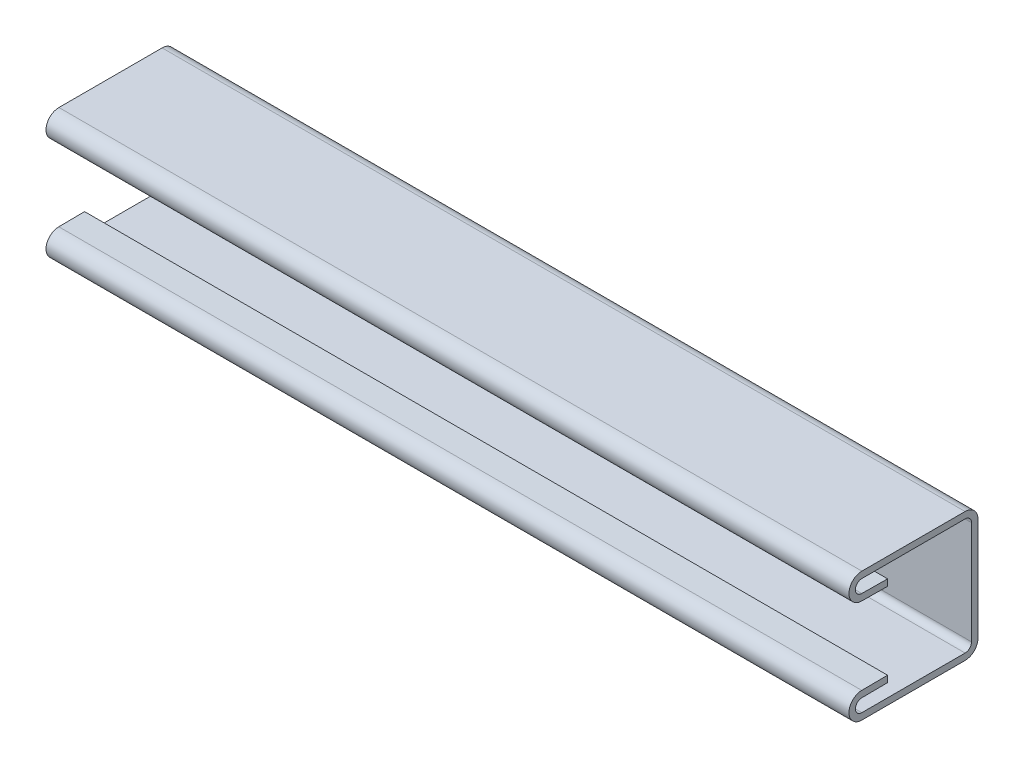
from build123d import *

# Parameters (mm, degrees)
ABC_DEPTH = 124.457734282


with BuildPart() as part:
    # Sketch15 → ABC (new body)
    with BuildSketch(Plane(origin=(0, 0, 0), x_dir=(0, -1, 0), z_dir=(-1, 0, 0))):
        with BuildLine():
            Line((-8, -9), (8, -9))
            ThreePointArc((8, -9), (8.707106781, -8.707106781), (9, -8))
            Line((9, -8), (9, 8))
            ThreePointArc((9, 8), (8.004363309, 8.999990481), (7.000038077, 8.008726535))
            Line((7.000038077, 8.008726535), (6.965131935, 4.008878843))
            Line((6.965131935, 4.008878843), (5.965170012, 4.017605379))
            Line((5.965170012, 4.017605379), (6.000076154, 8.017453071))
            ThreePointArc((6.000076154, 8.017453071), (8.008726619, 9.999980961), (10, 8))
            Line((10, 8), (10, -8))
            ThreePointArc((10, -8), (9.414213562, -9.414213562), (8, -10))
            Line((8, -10), (-8, -10))
            ThreePointArc((-8, -10), (-9.414213562, -9.414213562), (-10, -8))
            Line((-10, -8), (-10, 8))
            ThreePointArc((-10, 8), (-8.008726619, 9.999980961), (-6.000076154, 8.017453071))
            Line((-6.000076154, 8.017453071), (-5.965170012, 4.017605379))
            Line((-5.965170012, 4.017605379), (-6.965131935, 4.008878843))
            Line((-6.965131935, 4.008878843), (-7.000038077, 8.008726535))
            ThreePointArc((-7.000038077, 8.008726535), (-8.004363309, 8.999990481), (-9, 8))
            Line((-9, 8), (-9, -8))
            ThreePointArc((-9, -8), (-8.707106781, -8.707106781), (-8, -9))
        make_face()
    extrude(amount=ABC_DEPTH)


solid = part.part
